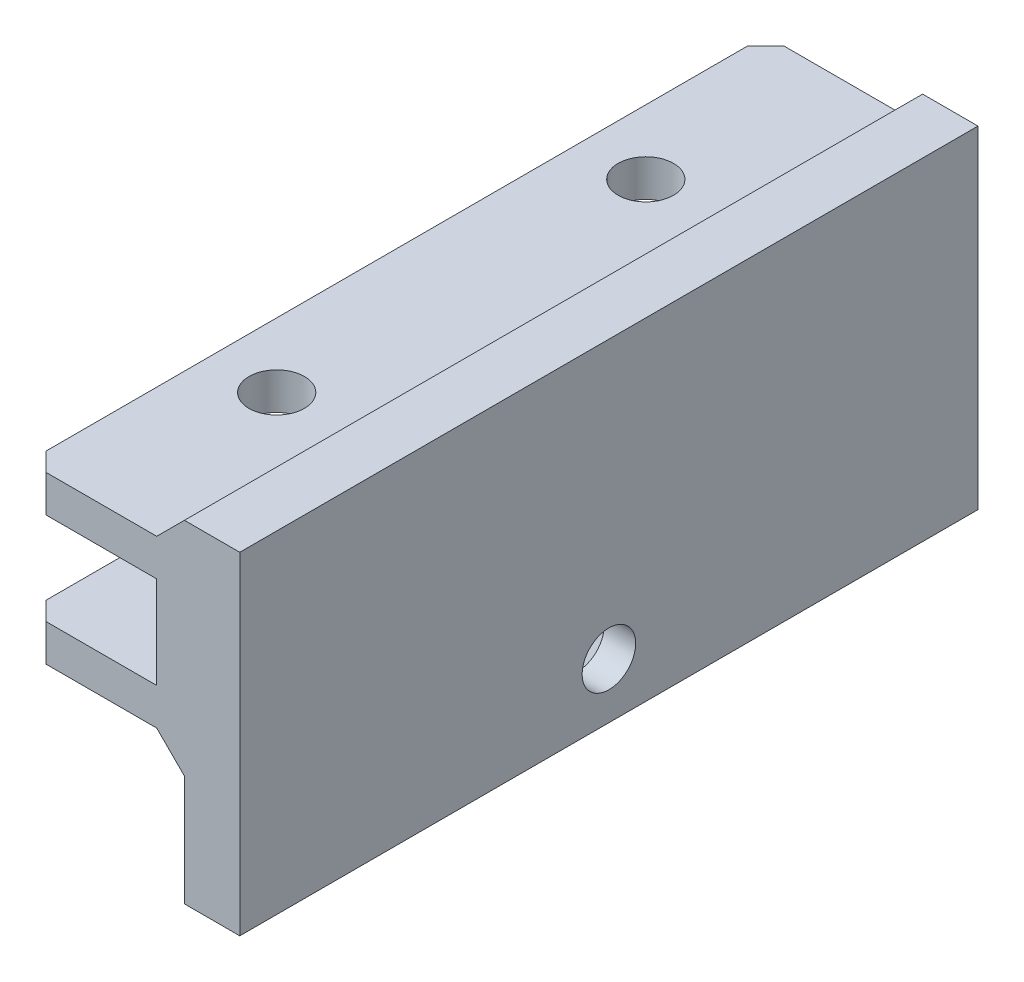
from build123d import *

# Parameters (mm, degrees)
SALIENTE_EXTRUIR1_DEPTH                              = 20
TALADRO_DE_MARGEN_PARA_M31_D                         = 3
CHAFL_N2_SIZE                                        = 1
CROQUIS4_W                                           = 3
CROQUIS4_H                                           = 40
SALIENTE_EXTRUIR2_DEPTH                              = 6
AVELLANADO_PARA_TORNILLO_CON_CABEZA_OVAL_D           = 2.9
AVELLANADO_PARA_TORNILLO_CON_CABEZA_OVAL_CSINK_D     = 5.5
AVELLANADO_PARA_TORNILLO_CON_CABEZA_OVAL_CSINK_ANGLE = 90


with BuildPart() as part:
    # Croquis1 → Saliente-Extruir1 (new, symmetric)
    with BuildSketch(Plane(origin=(0, 0, 0), x_dir=(0, 1, 0), z_dir=(0, 0, 1))):
        Polygon((-6, 0), (6, 0), (6, 3), (4.5, 4.5), (4.5, 11.5), (2.5, 11.5), (2.5, 4.5), (-2.5, 4.5), (-2.5, 11.5), (-4.5, 11.5), (-4.5, 4.5), (-6, 3), align=None)
    extrude(amount=SALIENTE_EXTRUIR1_DEPTH, both=True)

    # Taladro de margen para M31 (through all)
    with Locations(Plane(origin=(0, 4.5, 0), x_dir=(-1, 0, 0), z_dir=(0, 1, 0))):
        with Locations((8, -10), (8, 10)):
            Hole(TALADRO_DE_MARGEN_PARA_M31_D / 2)

    # Chaflán2
    chafl_n2_edges = [part.edges().sort_by_distance(p)[0] for p in [
        (-11.5, -3.5, -20),
        (-11.5, 3.5, -20),
        (-11.5, 3.5, 20),
        (-11.5, -3.5, 20),
    ]]
    chamfer(chafl_n2_edges, length=CHAFL_N2_SIZE)

    # Croquis4 → Saliente-Extruir2 (add)
    with BuildSketch(Plane.XZ.offset(6)):
        with Locations((-1.5, 0)):
            Rectangle(CROQUIS4_W, CROQUIS4_H)
    extrude(amount=SALIENTE_EXTRUIR2_DEPTH)

    # Avellanado para tornillo con cabeza ovalada de M2.51 (through all)
    with Locations(Plane(origin=(-3, 0, 0), x_dir=(0, -1, 0), z_dir=(-1, 0, 0))):
        with Locations((9, 0)):
            CounterSinkHole(AVELLANADO_PARA_TORNILLO_CON_CABEZA_OVAL_D / 2, AVELLANADO_PARA_TORNILLO_CON_CABEZA_OVAL_CSINK_D / 2, counter_sink_angle=AVELLANADO_PARA_TORNILLO_CON_CABEZA_OVAL_CSINK_ANGLE)


solid = part.part
